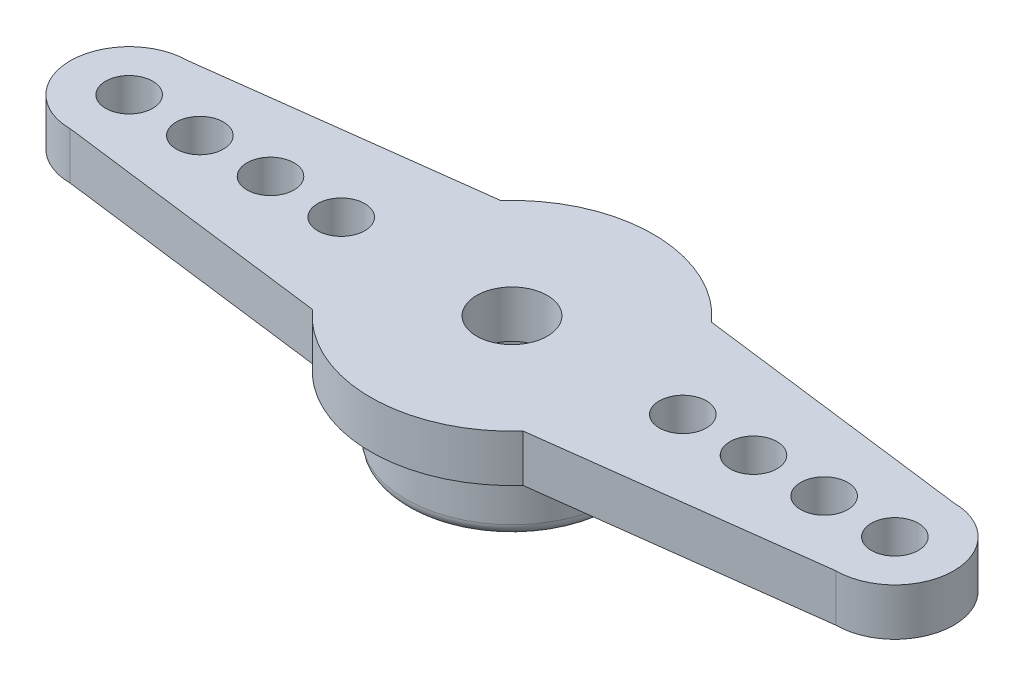
from build123d import *

# Parameters (mm, degrees)
BOSS_EXTRUDE1_DEPTH = 2
SKETCH3_R           = 1
SKETCH3_R_2         = 1.5
CUT_EXTRUDE1_DEPTH  = 20.787938245
SKETCH4_R           = 4.5
SKETCH4_R_2         = 3.179560916
BOSS_EXTRUDE2_DEPTH = 3
FILLET1_R           = 0.5


with BuildPart() as part:
    # Sketch1 → Boss-Extrude1 (new body)
    with BuildSketch(Plane(origin=(0, 0, 0), x_dir=(1, 0, 0), z_dir=(0, 1, 0))):
        with BuildLine():
            Line((4.472135955, 4), (16.25, 2.5))
            ThreePointArc((16.25, 2.5), (18.75, 0), (16.25, -2.5))
            Line((16.25, -2.5), (4.472135955, -4))
            ThreePointArc((4.472135955, -4), (0, -6), (-4.472135955, -4))
            Line((-4.472135955, -4), (-16.25, -2.5))
            ThreePointArc((-16.25, -2.5), (-18.75, 0), (-16.25, 2.5))
            Line((-16.25, 2.5), (-4.472135955, 4))
            ThreePointArc((-4.472135955, 4), (0, 6), (4.472135955, 4))
        make_face()
    extrude(amount=BOSS_EXTRUDE1_DEPTH)

    # Sketch3 → Cut-Extrude1 (cut, through all)
    with BuildSketch(Plane(origin=(0, 2, 0), x_dir=(1, 0, 0), z_dir=(0, 1, 0))):
        with Locations(Location((-10.25, 0, 0), (0, 0, 270))):
            Circle(SKETCH3_R)
        with Locations(Location((-7.25, 0, 0), (0, 0, 270))):
            Circle(SKETCH3_R)
        with Locations(Location((0, 0, 0), (0, 0, 270))):
            Circle(SKETCH3_R_2)
        with Locations(Location((13.25, 0, 0), (0, 0, 270))):
            Circle(SKETCH3_R)
        with Locations(Location((16.25, 0, 0), (0, 0, 270))):
            Circle(SKETCH3_R)
        with Locations(Location((10.25, 0, 0), (0, 0, 270))):
            Circle(SKETCH3_R)
        with Locations(Location((-16.25, 0, 0), (0, 0, 270))):
            Circle(SKETCH3_R)
        with Locations(Location((-13.25, 0, 0), (0, 0, 270))):
            Circle(SKETCH3_R)
        with Locations(Location((7.25, 0, 0), (0, 0, 90))):
            Circle(SKETCH3_R)
    extrude(amount=-CUT_EXTRUDE1_DEPTH, mode=Mode.SUBTRACT)

    # Sketch4 → Boss-Extrude2 (add)
    with BuildSketch(Plane.XZ):
        with Locations(Location((0, 0, 0), (0, 0, 90))):
            Circle(SKETCH4_R)
        with Locations(Location((0, 0, 0), (0, 0, 270))):
            Circle(SKETCH4_R_2, mode=Mode.SUBTRACT)
    extrude(amount=BOSS_EXTRUDE2_DEPTH)

    # Fillet1
    fillet1_edges = [part.edges().sort_by_distance(p)[0] for p in [
        (0, -3, -4.5),
    ]]
    fillet(fillet1_edges, radius=FILLET1_R)


solid = part.part
